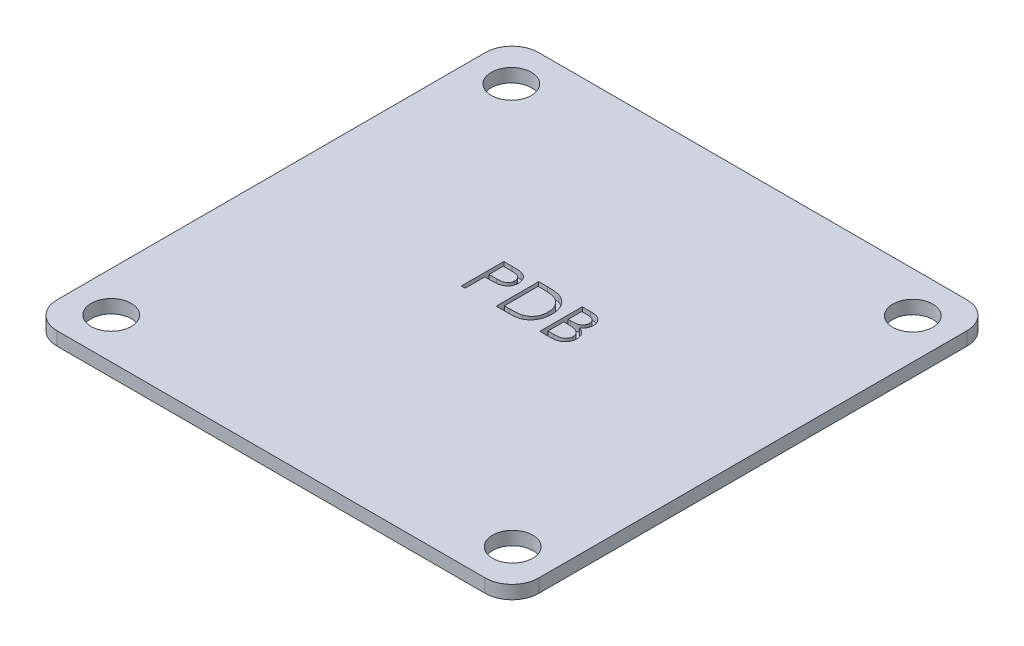
from build123d import *

# Parameters (mm, degrees)
SKETCH1_W             = 36
SKETCH1_H             = 36
SKETCH1_R             = 1.5
BOSS_EXTRUDE1_DEPTH   = 1
CUT_EXTRUDE1_DEPTH    = 0.5
BODY_MOVE_COPY1_ANGLE = 180
FILLET1_R             = 2


with BuildPart() as part:
    # Sketch1 → Boss-Extrude1 (new body)
    with BuildSketch(Plane(origin=(0, 0, 0), x_dir=(1, 0, 0), z_dir=(0, 1, 0))):
        with Locations((18, 18)):
            Rectangle(SKETCH1_W, SKETCH1_H)
        with Locations(Location((3, 32.95, 0), (0, 0, 270))):
            Circle(SKETCH1_R, mode=Mode.SUBTRACT)
        with Locations(Location((33, 32.95, 0), (0, 0, 270))):
            Circle(SKETCH1_R, mode=Mode.SUBTRACT)
        with Locations(Location((3, 3.05, 0), (0, 0, 270))):
            Circle(SKETCH1_R, mode=Mode.SUBTRACT)
        with Locations(Location((33, 3.05, 0), (0, 0, 270))):
            Circle(SKETCH1_R, mode=Mode.SUBTRACT)
    extrude(amount=BOSS_EXTRUDE1_DEPTH)

    # Sketch2 → Cut-Extrude1 (cut)
    # profile 1 of 3: a face of its own
    with BuildSketch(Plane(origin=(0, 0, 0), x_dir=(-1, 0, 0), z_dir=(0, -1, 0))):
        with BuildLine():
            Line((-14.214423077, 14.825), (-14.837084335, 14.825))
            add(Edge.make_bspline(
                [(-14.837084335, 14.825), (-14.879911371, 14.825047077), (-14.961969875, 14.82513728), (-15.079639961, 14.827872085), (-15.186510218, 14.83152487), (-15.282350206, 14.836588444), (-15.367454809, 14.842572494), (-15.441438931, 14.850965415), (-15.5048841, 14.859728683), (-15.542899236, 14.868638102), (-15.560236378, 14.872701322)],
                knots=[0, 0, 0, 0, 1.415646017, 2.712440637, 3.8905458, 4.950247383, 5.884950622, 6.709939814, 7.411656543, 8, 8, 8, 8], degree=3))
            add(Edge.make_bspline(
                [(-15.560236378, 14.872701322), (-15.58218323, 14.878708558), (-15.625559784, 14.890581476), (-15.688064891, 14.914358446), (-15.747524103, 14.942564145), (-15.804186135, 14.974662729), (-15.857080302, 15.012170044), (-15.90785806, 15.052921295), (-15.955454527, 15.098564559), (-15.999151011, 15.149039743), (-16.03963769, 15.2026933), (-16.073527943, 15.260893367), (-16.10345437, 15.321620959), (-16.126776306, 15.38635876), (-16.145108245, 15.454252238), (-16.158459415, 15.5254781), (-16.167040497, 15.599882695), (-16.167854734, 15.650738752), (-16.168269231, 15.676627604)],
                knots=[0, 0, 0, 0, 0.999333726, 1.975119402, 2.933498163, 3.889020618, 4.832249799, 5.779334906, 6.747801194, 7.724875447, 8.710438469, 9.696133548, 10.679360639, 11.681339199, 12.714023775, 13.766351759, 14.862936069, 16, 16, 16, 16], degree=3))
            add(Edge.make_bspline(
                [(-16.168269231, 15.676627604), (-16.167886938, 15.702733159), (-16.167138957, 15.75381044), (-16.158161613, 15.828534326), (-16.146069225, 15.899943151), (-16.12747547, 15.967878582), (-16.10312261, 16.031937173), (-16.074554819, 16.093097862), (-16.04009833, 16.150320136), (-16.000506235, 16.203811736), (-15.956463003, 16.25362287), (-15.90815498, 16.299392577), (-15.855777194, 16.340852941), (-15.799496102, 16.37809691), (-15.738763025, 16.410260821), (-15.674499071, 16.439069233), (-15.606145661, 16.463263695), (-15.558844952, 16.475990965), (-15.534795673, 16.482461939)],
                knots=[0, 0, 0, 0, 1.121902311, 2.195077645, 3.232258892, 4.234102512, 5.217864754, 6.176164875, 7.132989551, 8.084763148, 9.034132444, 9.988522005, 10.94243251, 11.903244335, 12.886203696, 13.894208494, 14.929344452, 16, 16, 16, 16], degree=3))
            add(Edge.make_bspline(
                [(-15.534795673, 16.482461939), (-15.514904222, 16.486688777), (-15.471310951, 16.495952137), (-15.399521697, 16.506363894), (-15.315895261, 16.514902673), (-15.220716177, 16.522871129), (-15.113762489, 16.527093415), (-14.995279498, 16.532051068), (-14.864866218, 16.534390313), (-14.773907021, 16.534538182), (-14.726417268, 16.534615385)],
                knots=[0, 0, 0, 0, 0.601372724, 1.317943291, 2.144091499, 3.08771165, 4.142394186, 5.309582461, 6.595334295, 8, 8, 8, 8], degree=3))
            Line((-14.726417268, 16.534615385), (-14.499358974, 16.534615385))
            Line((-14.499358974, 16.534615385), (-14.499358974, 18))
            Line((-14.499358974, 18), (-14.214423077, 18))
            Line((-14.214423077, 18), (-14.214423077, 14.825))
        make_face()
        with BuildLine():
            Line((-14.499358974, 15.150641026), (-14.499358974, 16.208974359))
            Line((-14.499358974, 16.208974359), (-15.055238381, 16.215970553))
            add(Edge.make_bspline(
                [(-15.055238381, 16.215970553), (-15.082380485, 16.21598845), (-15.134777757, 16.216022999), (-15.210671596, 16.21234584), (-15.280914054, 16.208345506), (-15.345608841, 16.201876016), (-15.404460674, 16.193985255), (-15.45761204, 16.183435268), (-15.505487113, 16.172674962), (-15.560633895, 16.154003923), (-15.622404075, 16.125836289), (-15.689446595, 16.083764418), (-15.74672893, 16.030764439), (-15.795879926, 15.970529413), (-15.83473043, 15.903449897), (-15.862887075, 15.831877993), (-15.880073307, 15.756085468), (-15.88223347, 15.704277864), (-15.883333333, 15.677899639)],
                knots=[0, 0, 0, 0, 1.160501667, 2.240324542, 3.248665471, 4.168823117, 5.020172044, 5.786515869, 6.485785279, 7.116517804, 8.272762037, 9.381837012, 10.485674779, 11.594342068, 12.695271952, 13.786226926, 14.872841088, 16, 16, 16, 16], degree=3))
            add(Edge.make_bspline(
                [(-15.883333333, 15.677899639), (-15.882184401, 15.652375996), (-15.879900465, 15.601638153), (-15.863029039, 15.527242072), (-15.834432243, 15.456483828), (-15.795848253, 15.389935981), (-15.747875088, 15.329861051), (-15.691731979, 15.278042247), (-15.628292427, 15.236100993), (-15.569740357, 15.208181099), (-15.517340865, 15.191808252), (-15.47204627, 15.179987886), (-15.420643834, 15.171835631), (-15.363620016, 15.164035455), (-15.301047824, 15.157739017), (-15.232529377, 15.153366568), (-15.158292905, 15.150834445), (-15.106757843, 15.15070706), (-15.080043069, 15.150641026)],
                knots=[0, 0, 0, 0, 1.12039168, 2.227199994, 3.330242575, 4.460839274, 5.593542475, 6.693949254, 7.801736126, 8.92216649, 9.528704869, 10.210659466, 10.975987387, 11.81211542, 12.738540127, 13.736887663, 14.826846554, 16, 16, 16, 16], degree=3))
            Line((-15.080043069, 15.150641026), (-14.499358974, 15.150641026))
        make_face(mode=Mode.SUBTRACT)
    # profile 2 of 3: a face of its own
    with BuildSketch(Plane(origin=(0, 0, 0), x_dir=(-1, 0, 0), z_dir=(0, -1, 0))):
        with BuildLine():
            Line((-16.819551282, 18), (-16.819551282, 14.825))
            Line((-16.819551282, 14.825), (-17.460657051, 14.825))
            add(Edge.make_bspline(
                [(-17.460657051, 14.825), (-17.516418321, 14.82540038), (-17.624148803, 14.826173913), (-17.779824256, 14.831106543), (-17.923658371, 14.839744267), (-18.055569465, 14.852568829), (-18.175769465, 14.867961897), (-18.284065857, 14.887538036), (-18.380634142, 14.910560901), (-18.440024161, 14.930197341), (-18.468108974, 14.939483173)],
                knots=[0, 0, 0, 0, 1.314317071, 2.539253741, 3.67075822, 4.709970291, 5.662644612, 6.526156501, 7.303037452, 8, 8, 8, 8], degree=3))
            add(Edge.make_bspline(
                [(-18.468108974, 14.939483173), (-18.504846773, 14.953476684), (-18.577489279, 14.98114638), (-18.680862336, 15.033421221), (-18.778506561, 15.092408718), (-18.869650949, 15.159461249), (-18.954496334, 15.233721962), (-19.034110254, 15.314590029), (-19.106210725, 15.404224354), (-19.173284511, 15.499843616), (-19.231991477, 15.602317972), (-19.28375974, 15.709594874), (-19.327961976, 15.821466172), (-19.362451594, 15.93874814), (-19.390945978, 16.060314332), (-19.410065011, 16.187085151), (-19.422765016, 16.318321514), (-19.42403507, 16.407380924), (-19.424679487, 16.452569111)],
                knots=[0, 0, 0, 0, 0.984696416, 1.947063185, 2.89840987, 3.841051395, 4.778753227, 5.721858861, 6.681155121, 7.65838316, 8.646299769, 9.637283673, 10.641736726, 11.657050558, 12.698485921, 13.768600492, 14.86780186, 16, 16, 16, 16], degree=3))
            add(Edge.make_bspline(
                [(-19.424679487, 16.452569111), (-19.424108539, 16.491813101), (-19.422983426, 16.569147483), (-19.412893056, 16.683123629), (-19.398198689, 16.793709694), (-19.37555304, 16.900420107), (-19.347726592, 17.003973317), (-19.31338166, 17.103879016), (-19.272674196, 17.200205107), (-19.225465098, 17.292186497), (-19.173773063, 17.379599522), (-19.117446104, 17.461059178), (-19.058412822, 17.537463594), (-18.994520165, 17.607086708), (-18.927883554, 17.672096605), (-18.856236585, 17.729609441), (-18.781822611, 17.782295236), (-18.702406018, 17.828554014), (-18.617335224, 17.869702572), (-18.524388059, 17.904452775), (-18.423903754, 17.934357914), (-18.315216478, 17.958184283), (-18.198688716, 17.977389544), (-18.074004586, 17.990179262), (-17.941397567, 17.998852287), (-17.850338934, 17.999610001), (-17.803470553, 18)],
                knots=[0, 0, 0, 0, 1.105894396, 2.179280415, 3.222964075, 4.248423888, 5.251546139, 6.243661943, 7.223682738, 8.196462441, 9.155694589, 10.083899862, 10.986397372, 11.874737962, 12.745335529, 13.607670254, 14.461432187, 15.313100333, 16.195087267, 17.121790994, 18.106827133, 19.14775296, 20.255889161, 21.433815148, 22.679170477, 24, 24, 24, 24], degree=3))
            Line((-17.803470553, 18), (-16.819551282, 18))
        make_face()
        with BuildLine():
            Line((-17.104487179, 17.674358974), (-17.46892528, 17.674358974))
            add(Edge.make_bspline(
                [(-17.46892528, 17.674358974), (-17.52129316, 17.674133916), (-17.62201577, 17.673701045), (-17.766848381, 17.669902653), (-17.899181834, 17.663696039), (-18.019034917, 17.655010075), (-18.126339961, 17.643517832), (-18.22132122, 17.630704527), (-18.303667347, 17.614741125), (-18.353496193, 17.600271326), (-18.376522436, 17.593584736)],
                knots=[0, 0, 0, 0, 1.375205317, 2.645023457, 3.804390687, 4.853969522, 5.800190428, 6.637939096, 7.370582563, 8, 8, 8, 8], degree=3))
            add(Edge.make_bspline(
                [(-18.376522436, 17.593584736), (-18.40550478, 17.583378727), (-18.462777226, 17.563210482), (-18.545210448, 17.526407862), (-18.622130014, 17.482867525), (-18.694818254, 17.434183346), (-18.762808024, 17.379603595), (-18.825784468, 17.318954694), (-18.884245023, 17.252938789), (-18.93725368, 17.181333438), (-18.985195805, 17.104933137), (-19.026617643, 17.02382299), (-19.061535783, 16.938458159), (-19.090183796, 16.849135641), (-19.112519423, 16.755802276), (-19.128244583, 16.658223843), (-19.13798928, 16.556438878), (-19.139152444, 16.487148173), (-19.13974359, 16.451933093)],
                knots=[0, 0, 0, 0, 0.998420628, 1.972994, 2.929372424, 3.86770908, 4.81360496, 5.759023883, 6.706048443, 7.676227424, 8.651287839, 9.634325482, 10.632389399, 11.645655052, 12.680158286, 13.74837235, 14.855672678, 16, 16, 16, 16], degree=3))
            add(Edge.make_bspline(
                [(-19.13974359, 16.451933093), (-19.139277468, 16.414800801), (-19.138361769, 16.341854085), (-19.126871395, 16.234816517), (-19.110044206, 16.131884775), (-19.085839608, 16.032984754), (-19.054569354, 15.938245125), (-19.01715196, 15.847130649), (-18.971721371, 15.760813883), (-18.920289141, 15.678563757), (-18.862547044, 15.601625896), (-18.79875122, 15.530901669), (-18.729574359, 15.466259334), (-18.655335275, 15.40759597), (-18.57499598, 15.355954824), (-18.489915973, 15.310015665), (-18.398896788, 15.270983025), (-18.335565508, 15.250230151), (-18.303380409, 15.239683494)],
                knots=[0, 0, 0, 0, 1.122272916, 2.204715076, 3.251197285, 4.274229216, 5.279697671, 6.265416158, 7.248880903, 8.225321784, 9.195852973, 10.153576302, 11.101466393, 12.055578741, 13.010401466, 13.985536859, 14.976245305, 16, 16, 16, 16], degree=3))
            add(Edge.make_bspline(
                [(-18.303380409, 15.239683494), (-18.276754726, 15.232320734), (-18.220141219, 15.216665487), (-18.127758277, 15.199588185), (-18.023785962, 15.184525532), (-17.907762662, 15.171772882), (-17.779820631, 15.162622241), (-17.639861472, 15.155753977), (-17.487824687, 15.151121532), (-17.382430532, 15.150805204), (-17.327729367, 15.150641026)],
                knots=[0, 0, 0, 0, 0.674548936, 1.434276114, 2.292660221, 3.240891867, 4.284742987, 5.42552168, 6.663806718, 8, 8, 8, 8], degree=3))
            Line((-17.327729367, 15.150641026), (-17.104487179, 15.150641026))
            Line((-17.104487179, 15.150641026), (-17.104487179, 17.674358974))
        make_face(mode=Mode.SUBTRACT)
    # profile 3 of 3: a face of its own
    with BuildSketch(Plane(origin=(0, 0, 0), x_dir=(-1, 0, 0), z_dir=(0, -1, 0))):
        with BuildLine():
            Line((-20.075961538, 14.825), (-20.695442708, 14.825))
            add(Edge.make_bspline(
                [(-20.695442708, 14.825), (-20.725767592, 14.825156921), (-20.784544763, 14.825461072), (-20.870008757, 14.830287737), (-20.95008555, 14.836704332), (-21.024633636, 14.847467824), (-21.094138088, 14.858628146), (-21.15789329, 14.875008826), (-21.216433272, 14.893101885), (-21.286727807, 14.92094051), (-21.366486589, 14.964174247), (-21.452212356, 15.028293986), (-21.526730424, 15.105168377), (-21.590092869, 15.192772808), (-21.64094258, 15.28914761), (-21.677264702, 15.392219247), (-21.700599417, 15.500253662), (-21.702969078, 15.574321243), (-21.704166667, 15.611753806)],
                knots=[0, 0, 0, 0, 1.00128172, 1.940733171, 2.826250472, 3.653024905, 4.427672124, 5.149348099, 5.824709082, 6.450061444, 7.643590664, 8.808605388, 9.972104426, 11.165284501, 12.367876273, 13.557044126, 14.765369432, 16, 16, 16, 16], degree=3))
            add(Edge.make_bspline(
                [(-21.704166667, 15.611753806), (-21.703188459, 15.646821674), (-21.70126619, 15.715733341), (-21.68248717, 15.816186738), (-21.654140694, 15.912110727), (-21.613235009, 16.002580893), (-21.561076822, 16.086802276), (-21.497618551, 16.163338275), (-21.422374433, 16.230686236), (-21.365880734, 16.268166335), (-21.337184495, 16.287204527)],
                knots=[0, 0, 0, 0, 1.044356178, 2.052258378, 3.035953355, 4.020338374, 5.002448483, 5.980768927, 6.974322109, 8, 8, 8, 8], degree=3))
            add(Edge.make_bspline(
                [(-21.337184495, 16.287204527), (-21.373255443, 16.301045853), (-21.442268101, 16.327527739), (-21.53736133, 16.37452874), (-21.619318239, 16.425257679), (-21.689195031, 16.480086384), (-21.747746844, 16.540805168), (-21.799907151, 16.605814962), (-21.844174, 16.677379834), (-21.881943499, 16.753949009), (-21.911862943, 16.835117005), (-21.932631198, 16.920276589), (-21.945802491, 17.00846321), (-21.947524878, 17.068399436), (-21.948397436, 17.098763021)],
                knots=[0, 0, 0, 0, 1.272200328, 2.434034374, 3.488177493, 4.442517805, 5.351202203, 6.260825393, 7.183200622, 8.11705787, 9.069326169, 10.026320267, 11.000137371, 12, 12, 12, 12], degree=3))
            add(Edge.make_bspline(
                [(-21.948397436, 17.098763021), (-21.947511212, 17.129757203), (-21.945767541, 17.190739126), (-21.932905496, 17.280324877), (-21.911121342, 17.365933729), (-21.881137514, 17.448135531), (-21.842052086, 17.526448851), (-21.794832827, 17.601489144), (-21.738159757, 17.672144303), (-21.674340305, 17.73943962), (-21.603136159, 17.80097828), (-21.52467476, 17.853862582), (-21.440966994, 17.899540927), (-21.350866581, 17.936263754), (-21.255012847, 17.965011011), (-21.153383336, 17.984886817), (-21.046035756, 17.998332925), (-20.972365841, 17.999434879), (-20.934585337, 18)],
                knots=[0, 0, 0, 0, 0.978522333, 1.925270105, 2.85076145, 3.763600118, 4.682725947, 5.609499657, 6.557784645, 7.537954401, 8.534920712, 9.522742111, 10.520247711, 11.5409147, 12.58930695, 13.675078472, 14.807699069, 16, 16, 16, 16], degree=3))
            Line((-20.934585337, 18), (-20.075961538, 18))
            Line((-20.075961538, 18), (-20.075961538, 14.825))
        make_face()
        with BuildLine():
            Line((-20.360897436, 15.150641026), (-20.360897436, 16.168269231))
            Line((-20.360897436, 16.168269231), (-20.552338742, 16.168269231))
            add(Edge.make_bspline(
                [(-20.552338742, 16.168269231), (-20.580323258, 16.167909462), (-20.634395047, 16.167214317), (-20.712907617, 16.165160292), (-20.785603617, 16.159660798), (-20.852733526, 16.153844164), (-20.913847463, 16.144887778), (-20.969149853, 16.13392756), (-21.019138031, 16.122437825), (-21.076757463, 16.102841292), (-21.142107778, 16.074182831), (-21.2112853, 16.028618136), (-21.273548179, 15.975864071), (-21.324911461, 15.913289506), (-21.367673257, 15.845714635), (-21.396463114, 15.772635549), (-21.416536473, 15.696570575), (-21.418323471, 15.644112234), (-21.419230769, 15.617477965)],
                knots=[0, 0, 0, 0, 1.156584208, 2.234756387, 3.244705828, 4.168772894, 5.018724976, 5.795346628, 6.498686023, 7.135894168, 8.308330183, 9.43588092, 10.547699294, 11.667188675, 12.76860303, 13.837480448, 14.902040606, 16, 16, 16, 16], degree=3))
            add(Edge.make_bspline(
                [(-21.419230769, 15.617477965), (-21.418788265, 15.599845497), (-21.417920245, 15.565257486), (-21.409737074, 15.514864741), (-21.398444397, 15.466910763), (-21.379819958, 15.422688306), (-21.357754813, 15.380644538), (-21.329472567, 15.342107543), (-21.296860535, 15.306033348), (-21.258838993, 15.273388889), (-21.215563366, 15.24386386), (-21.165662783, 15.219285683), (-21.110493921, 15.197443357), (-21.048906335, 15.180886362), (-20.982126795, 15.166512255), (-20.909136481, 15.157448022), (-20.830375284, 15.151625016), (-20.775804654, 15.150976338), (-20.747596154, 15.150641026)],
                knots=[0, 0, 0, 0, 0.911412742, 1.787835618, 2.63643285, 3.453173233, 4.262886967, 5.08783453, 5.918594724, 6.773969545, 7.67442701, 8.62112486, 9.645634318, 10.739428598, 11.916091468, 13.177237585, 14.540865421, 16, 16, 16, 16], degree=3))
            Line((-20.747596154, 15.150641026), (-20.360897436, 15.150641026))
        make_face(mode=Mode.SUBTRACT)
        with BuildLine():
            Line((-20.360897436, 16.493910256), (-20.360897436, 17.674358974))
            Line((-20.360897436, 17.674358974), (-20.766676683, 17.674358974))
            add(Edge.make_bspline(
                [(-20.766676683, 17.674358974), (-20.795719519, 17.673977387), (-20.851695757, 17.673241928), (-20.932577314, 17.671496784), (-21.007143918, 17.665022306), (-21.076016416, 17.658814977), (-21.138876141, 17.648674015), (-21.196334511, 17.638854064), (-21.24707915, 17.624403522), (-21.306453309, 17.60451932), (-21.372862709, 17.57274173), (-21.445384906, 17.526010062), (-21.509261877, 17.469087446), (-21.56345701, 17.403544285), (-21.608517888, 17.333014359), (-21.639691116, 17.257358853), (-21.659889593, 17.179104783), (-21.662268493, 17.12559752), (-21.663461538, 17.098763021)],
                knots=[0, 0, 0, 0, 1.16016216, 2.236059617, 3.229676189, 4.14889023, 4.996733752, 5.772278665, 6.474820656, 7.101410824, 8.271817372, 9.403828207, 10.537358096, 11.673541442, 12.791884111, 13.865947414, 14.929748409, 16, 16, 16, 16], degree=3))
            add(Edge.make_bspline(
                [(-21.663461538, 17.098763021), (-21.663218001, 17.081984403), (-21.662734855, 17.048697807), (-21.655140281, 16.999825141), (-21.644600954, 16.952248989), (-21.629068947, 16.906615593), (-21.610279442, 16.862139153), (-21.585491297, 16.820266851), (-21.557530453, 16.77921625), (-21.514223335, 16.726707986), (-21.450373784, 16.666939881), (-21.359609394, 16.609154389), (-21.256984152, 16.561797377), (-21.182375855, 16.541777202), (-21.143835136, 16.531435296)],
                knots=[0, 0, 0, 0, 0.723354195, 1.435040621, 2.129761981, 2.824182007, 3.512608497, 4.209435533, 4.920062464, 5.654614313, 7.143585817, 8.671381114, 10.280521501, 12, 12, 12, 12], degree=3))
            add(Edge.make_bspline(
                [(-21.143835136, 16.531435296), (-21.128387328, 16.528300831), (-21.094893293, 16.521504664), (-21.040276139, 16.514335298), (-20.977713805, 16.507904144), (-20.907473692, 16.503271916), (-20.829276446, 16.498299301), (-20.74314719, 16.496434267), (-20.649025034, 16.494157894), (-20.583717588, 16.493994914), (-20.549794671, 16.493910256)],
                knots=[0, 0, 0, 0, 0.634452549, 1.375623993, 2.216454381, 3.166361212, 4.209414599, 5.370755378, 6.634280627, 8, 8, 8, 8], degree=3))
            Line((-20.549794671, 16.493910256), (-20.360897436, 16.493910256))
        make_face(mode=Mode.SUBTRACT)
    extrude(amount=-CUT_EXTRUDE1_DEPTH, mode=Mode.SUBTRACT)


with BuildPart() as part_1:
    # Body-Move/Copy1: moved
    add(part.part.rotate(Axis((0, 0.5, -18), (1, 0, 0)), BODY_MOVE_COPY1_ANGLE))

    # Fillet1
    fillet1_edges = [part_1.edges().sort_by_distance(p)[0] for p in [
        (0, 0.5, 0),
        (36, 0.5, 0),
        (36, 0.5, -36),
        (0, 0.5, -36),
    ]]
    fillet(fillet1_edges, radius=FILLET1_R)


solid = part_1.part
